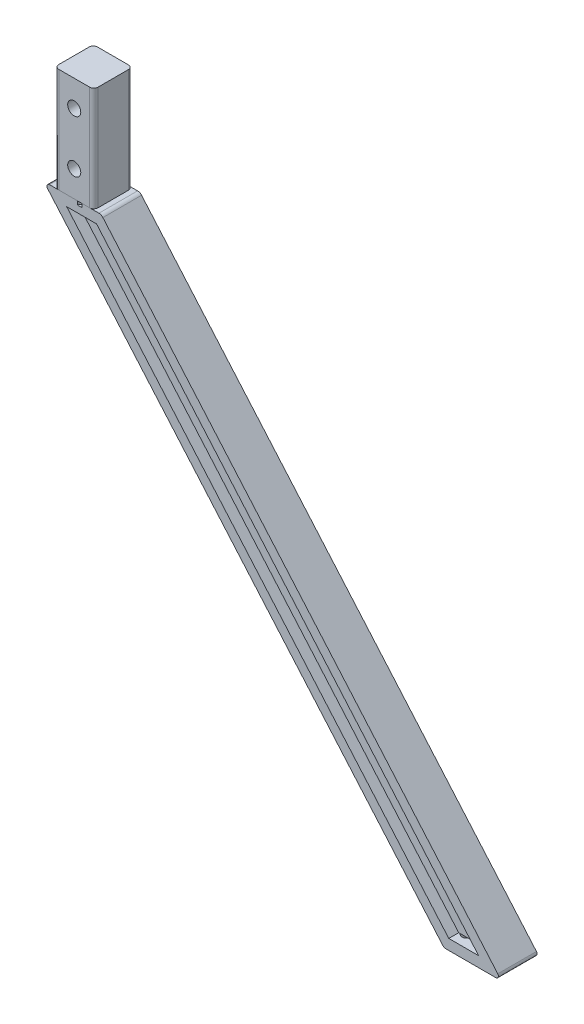
from build123d import *

# Parameters (mm, degrees)
BOSS_EXTRUDE1_DEPTH     = 18.796
CUT_EXTRUDE1_DEPTH      = 4.826
CUT_EXTRUDE2_DEPTH      = 4.826
SKETCH5_R               = 1.143
CUT_EXTRUDE3_DEPTH      = 296.890463183
SKETCH6_R               = 2.286
CUT_EXTRUDE4_DEPTH      = 294.404061537
BOSS_EXTRUDE2_DEPTH     = 50.8
CUT_EXTRUDE5_DEPTH      = 338.372318672
CUT_EXTRUDE5_DEPTH_BACK = 338.372318672
SKETCH10_R              = 3.175


with BuildPart() as part:
    # Sketch1 → Boss-Extrude1 (new body)
    with BuildSketch(Plane.XY):
        with BuildLine():
            Line((-0.759864647, 0.880311666), (-192.659480012, 223.198155833))
            ThreePointArc((-192.659480012, 223.198155833), (-192.85282615, 224.556676606), (-191.698096292, 225.298))
            Line((-191.698096292, 225.298), (-167.694919671, 225.298))
            ThreePointArc((-167.694919671, 225.298), (-166.637566458, 225.067459717), (-165.772152229, 224.417688334))
            Line((-165.772152229, 224.417688334), (26.127463136, 2.099844167))
            ThreePointArc((26.127463136, 2.099844167), (26.320809274, 0.741323394), (25.166079416, 0))
            Line((25.166079416, 0), (1.162902795, 0))
            ThreePointArc((1.162902795, 0), (0.105549582, 0.230540283), (-0.759864647, 0.880311666))
        make_face()
    extrude(amount=BOSS_EXTRUDE1_DEPTH)

    # Sketch3 → Cut-Extrude1 (cut)
    with BuildSketch(Plane.XY.offset(18.796)):
        Polygon((-183.376334539, 220.218), (2.32580559, 5.08), (16.844317663, 5.08), (-168.857822466, 220.218), align=None)
    extrude(amount=-CUT_EXTRUDE1_DEPTH, mode=Mode.SUBTRACT)

    # Sketch4 → Cut-Extrude2 (cut)
    with BuildSketch(Plane(origin=(0, 0, 0), x_dir=(-1, 0, 0), z_dir=(0, 0, -1))):
        Polygon((183.376334539, 220.218), (168.857822466, 220.218), (-16.844317663, 5.08), (-2.32580559, 5.08), align=None)
    extrude(amount=-CUT_EXTRUDE2_DEPTH, mode=Mode.SUBTRACT)

    # Sketch5 → Cut-Extrude3 (cut, through all)
    with BuildSketch(Plane.XZ.offset(-223.52)):
        with Locations((-176.948152229, 0)):
            Circle(SKETCH5_R)
        with Locations((-176.948152229, 18.796)):
            Circle(SKETCH5_R)
    extrude(amount=-CUT_EXTRUDE3_DEPTH, mode=Mode.SUBTRACT)

    # Sketch6 → Cut-Extrude4 (cut, through all)
    with BuildSketch(Plane(origin=(0, 5.08, 0), x_dir=(1, 0, 0), z_dir=(0, 1, 0))):
        with Locations(Location((4.993109193, -12.7, 0), (0, 0, 270))):
            Circle(SKETCH6_R)
        with Locations(Location((4.993109193, -6.096, 0), (0, 0, 33.748988596))):
            Circle(SKETCH6_R)
    extrude(amount=-CUT_EXTRUDE4_DEPTH, mode=Mode.SUBTRACT)


with BuildPart() as body_2:
    # Sketch9 → Boss-Extrude2 (new body)
    with BuildSketch(Plane(origin=(0, 225.298, 0), x_dir=(1, 0, 0), z_dir=(0, 1, 0))):
        with BuildLine():
            Line((-187.189507981, 0), (-172.203507981, 0))
            ThreePointArc((-172.203507981, 0), (-170.766667002, -0.595159021), (-170.171507981, -2.032))
            Line((-170.171507981, -2.032), (-170.171507981, -16.764))
            ThreePointArc((-170.171507981, -16.764), (-170.766667002, -18.200840979), (-172.203507981, -18.796))
            Line((-172.203507981, -18.796), (-187.189507981, -18.796))
            ThreePointArc((-187.189507981, -18.796), (-188.626348961, -18.200840979), (-189.221507981, -16.764))
            Line((-189.221507981, -16.764), (-189.221507981, -2.032))
            ThreePointArc((-189.221507981, -2.032), (-188.626348961, -0.595159021), (-187.189507981, 0))
        make_face()
    extrude(amount=BOSS_EXTRUDE2_DEPTH)

    # Sketch10 → Cut-Extrude5 (cut, two sides: drawn at the far end of the back side and taken through both)
    with BuildSketch(Plane.XY.offset(18.796).offset(-CUT_EXTRUDE5_DEPTH_BACK)):
        with Locations((-179.696507981, 237.998)):
            Circle(SKETCH10_R)
        with Locations((-179.696507981, 263.398)):
            Circle(SKETCH10_R)
    extrude(amount=CUT_EXTRUDE5_DEPTH + CUT_EXTRUDE5_DEPTH_BACK, mode=Mode.SUBTRACT)


solid = Compound([part.part, body_2.part])
